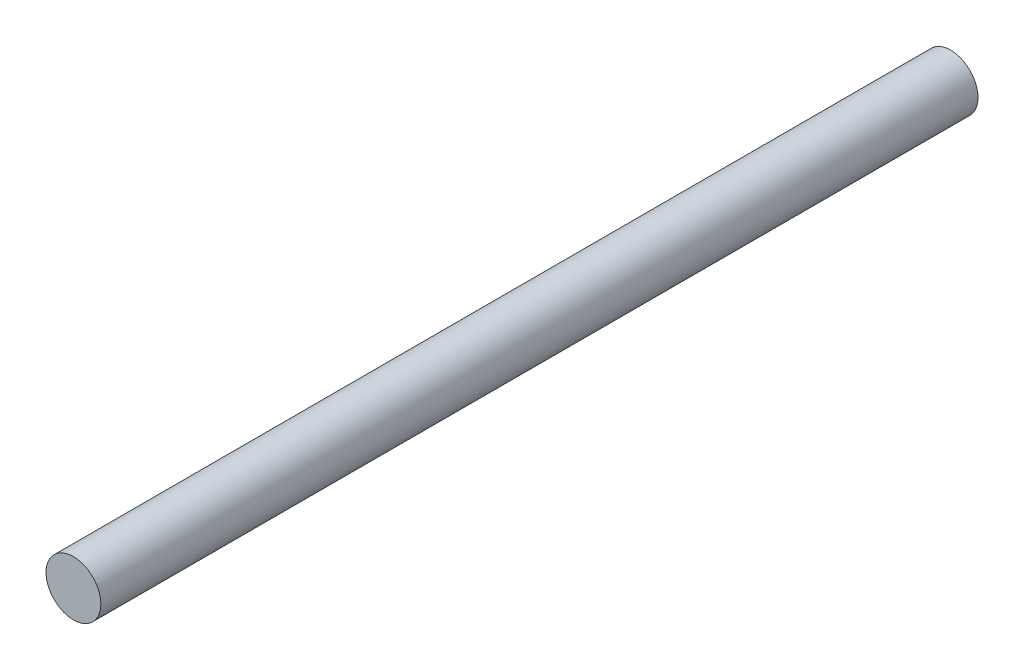
from build123d import *

# Parameters (mm, degrees)
SKETCH1_R           = 2.5
BOSS_EXTRUDE1_DEPTH = 60
BOSS_EXTRUDE2_START = 20
SKETCH3_R           = 2.5
BOSS_EXTRUDE2_DEPTH = 20


with BuildPart() as part:
    # Sketch1 → Boss-Extrude1 (new body)
    with BuildSketch(Plane.XY):
        Circle(SKETCH1_R)
    extrude(amount=BOSS_EXTRUDE1_DEPTH)

    # Sketch3 → Boss-Extrude2 (add)
    with BuildSketch(Plane(origin=(0, 0, 0), x_dir=(-1, 0, 0), z_dir=(0, 0, -1)).offset(BOSS_EXTRUDE2_START)):
        Circle(SKETCH3_R)
    extrude(amount=-BOSS_EXTRUDE2_DEPTH)


solid = part.part
